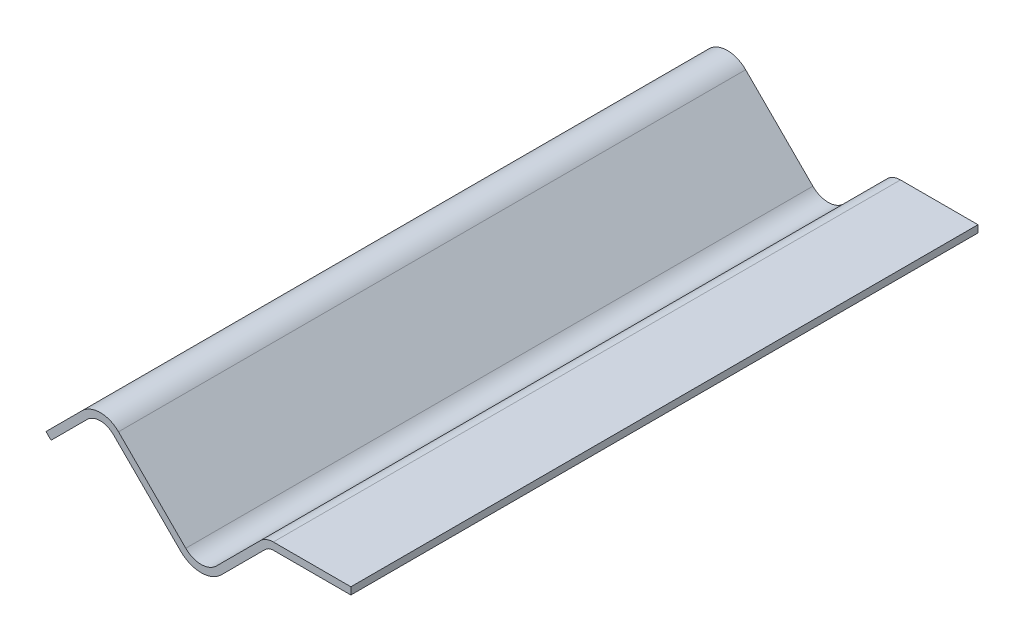
from build123d import *

# Parameters (mm, degrees)
BOSS_EXTRUDE1_DEPTH = 127


with BuildPart() as part:
    # Sketch2 → Boss-Extrude1 (new, symmetric)
    with BuildSketch(Plane.XY):
        with BuildLine():
            Line((0, 0), (14.587770823, 14.587770823))
            ThreePointArc((14.587770823, 14.587770823), (21.979122217, 17.649368814), (29.370473611, 14.587770823))
            Line((29.370473611, 14.587770823), (56.605513128, -12.647268694))
            ThreePointArc((56.605513128, -12.647268694), (62.818340236, -15.220705943), (69.031167343, -12.647268694))
            Line((69.031167343, -12.647268694), (86.762233624, 5.083797586))
            ThreePointArc((86.762233624, 5.083797586), (89.202287645, 6.714189559), (92.08052761, 7.286707084))
            Line((92.08052761, 7.286707084), (123.484493194, 7.286707084))
            Line((123.484493194, 7.286707084), (123.484493194, 4.384500447))
            Line((123.484493194, 4.384500447), (92.08052761, 4.384500447))
            ThreePointArc((92.08052761, 4.384500447), (90.312914042, 4.032900248), (88.814403617, 3.031627593))
            Line((88.814403617, 3.031627593), (71.083337336, -14.699438688))
            ThreePointArc((71.083337336, -14.699438688), (62.818340236, -18.12291258), (54.553343135, -14.699438688))
            Line((54.553343135, -14.699438688), (27.318303618, 12.535600829))
            ThreePointArc((27.318303618, 12.535600829), (21.979122217, 14.747162178), (16.639940816, 12.535600829))
            Line((16.639940816, 12.535600829), (2.052169993, -2.052169993))
            Line((2.052169993, -2.052169993), (0, 0))
        make_face()
    extrude(amount=BOSS_EXTRUDE1_DEPTH, both=True)


solid = part.part
